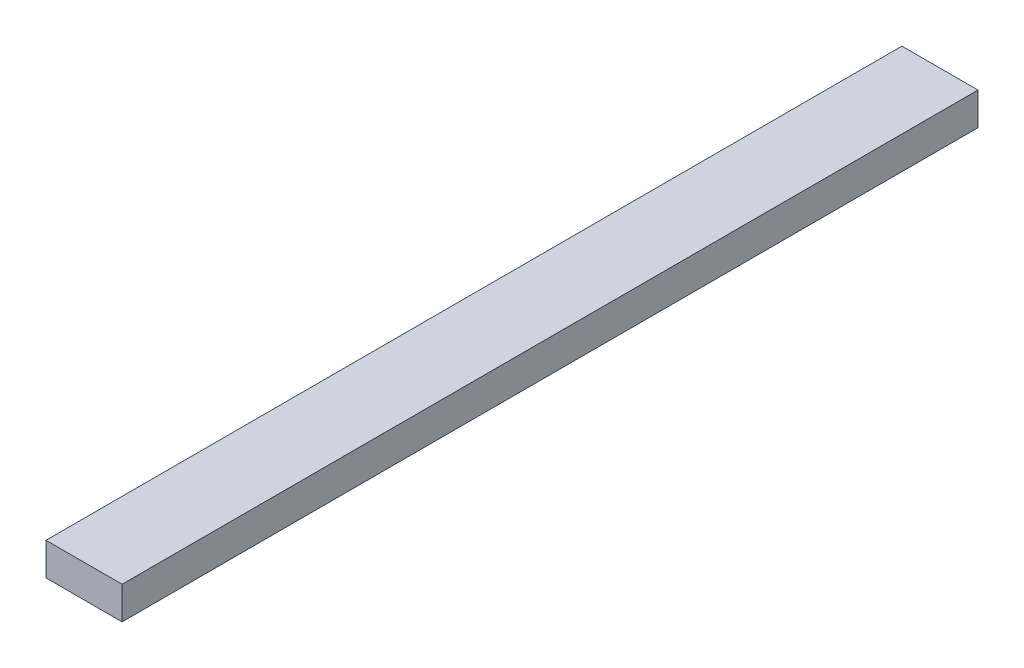
from build123d import *

# Parameters (mm, degrees)
SKETCH1_W           = 88.9
SKETCH1_H           = 38.1
BOSS_EXTRUDE1_DEPTH = 1000


with BuildPart() as part:
    # Sketch1 → Boss-Extrude1 (new body)
    with BuildSketch(Plane.XY):
        Rectangle(SKETCH1_W, SKETCH1_H)
    extrude(amount=BOSS_EXTRUDE1_DEPTH)


solid = part.part
